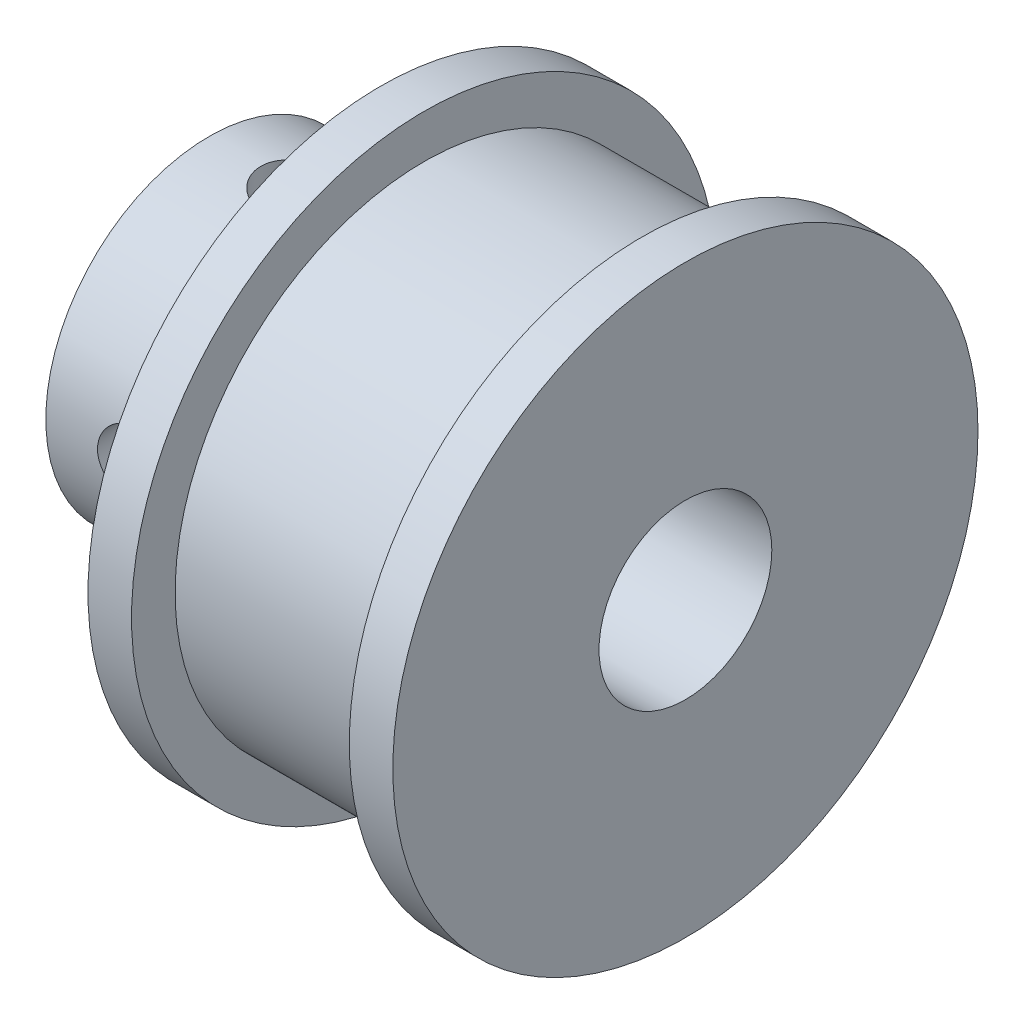
from build123d import *

# Parameters (mm, degrees)
SKETCH2_W = 1.25
SKETCH2_H = 10.75
SKETCH4_W = 1.25
SKETCH4_H = 10.75


with BuildPart() as part:
    # Sketch1 → Revolve1 (revolve)
    with BuildSketch(Plane.XY, mode=Mode.PRIVATE) as revolve1_sk:
        Polygon((0, 3.175), (0, 6), (6.3, 6), (6.3, 10.75), (7.9, 10.75), (7.9, 9.15), (15.9, 9.15), (15.9, 10.75), (17.5, 10.75), (17.5, 3.175), align=None)
    revolve(revolve1_sk.sketch.rotate(Axis((0, 0, 0), (-1, 0, 0)), 90), axis=Axis((0, 0, 0), (-1, 0, 0)))

    # Sketch2 → M3x0.5 Tapped Hole1 (revolve, cut)
    with BuildSketch(Plane(origin=(3.15, 0, 0), x_dir=(0, 0, -1), z_dir=(1, 0, 0))):
        with Locations((0.625, 5.375)):
            Rectangle(SKETCH2_W, SKETCH2_H)
    revolve(axis=Axis((3.15, -6.35, 0), (0, 1, 0)), mode=Mode.SUBTRACT)

    # Sketch4 → M3x0.5 Tapped Hole2 (revolve, cut)
    with BuildSketch(Plane.YZ.offset(3.15)):
        with Locations((0.625, 5.375)):
            Rectangle(SKETCH4_W, SKETCH4_H)
    revolve(axis=Axis((3.15, 0, -6.35), (0, 0, 1)), mode=Mode.SUBTRACT)


solid = part.part
